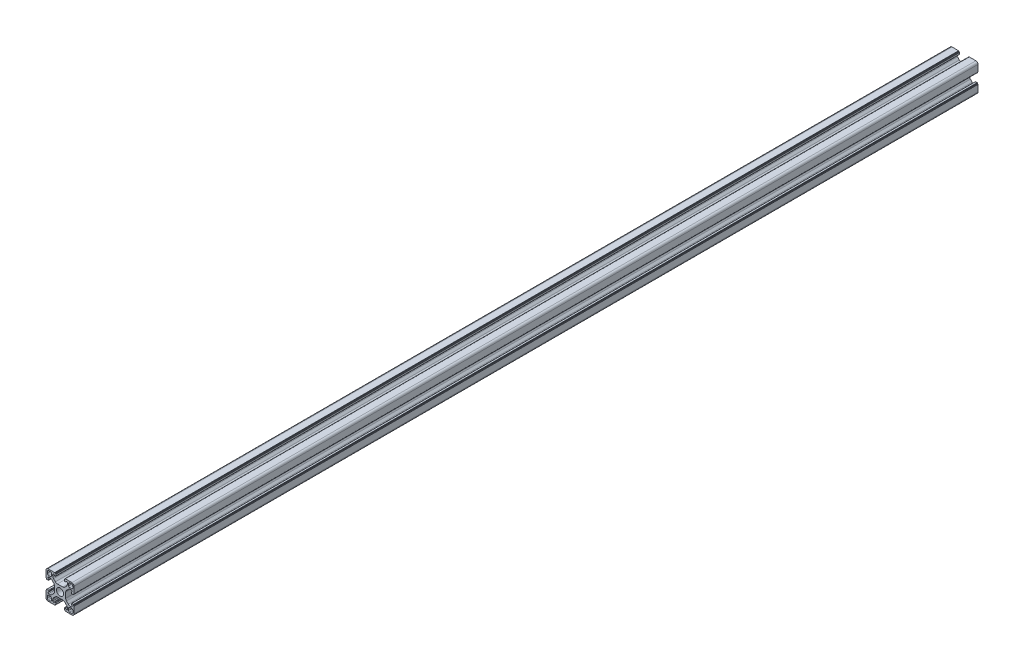
from build123d import *

# Parameters (mm, degrees)
EXTRUDE_1_DEPTH = 644


with BuildPart() as part:
    # Эскиз1 → Бобышка-Вытянуть1 (new body)
    with BuildSketch(Plane.XY):
        with BuildLine():
            Line((-18.466980253, 43.461877394), (-16.568199584, 43.461877394))
            ThreePointArc((-16.568199584, 43.461877394), (-15.80283272, 43.614118329), (-15.153986022, 44.047663832))
            Line((-15.153986022, 44.047663832), (-13.852766691, 45.348883163))
            ThreePointArc((-13.852766691, 45.348883163), (-13.419221188, 45.99772986), (-13.266980253, 46.763096725))
            Line((-13.266980253, 46.763096725), (-13.266980253, 47.661877394))
            ThreePointArc((-13.266980253, 47.661877394), (-13.413426863, 48.015430785), (-13.766980253, 48.161877394))
            Line((-13.766980253, 48.161877394), (-13.869873472, 48.161877394))
            ThreePointArc((-13.869873472, 48.161877394), (-14.061215188, 48.123817161), (-14.223426863, 48.015430785))
            Line((-14.223426863, 48.015430785), (-14.703756949, 47.535100699))
            ThreePointArc((-14.703756949, 47.535100699), (-14.784862786, 47.480907511), (-14.880533644, 47.461877394))
            Line((-14.880533644, 47.461877394), (-15.166980253, 47.461877394))
            ThreePointArc((-15.166980253, 47.461877394), (-15.343756949, 47.535100699), (-15.416980253, 47.711877394))
            Line((-15.416980253, 47.711877394), (-15.416980253, 48.860948215))
            ThreePointArc((-15.416980253, 48.860948215), (-15.373046271, 48.967014232), (-15.266980253, 49.010948215))
            Line((-15.266980253, 49.010948215), (-14.766980253, 49.010948215))
            Line((-14.766980253, 49.010948215), (-14.766980253, 49.311877394))
            ThreePointArc((-14.766980253, 49.311877394), (-14.723046271, 49.417943411), (-14.616980253, 49.461877394))
            Line((-14.616980253, 49.461877394), (-9.966980253, 49.461877394))
            ThreePointArc((-9.966980253, 49.461877394), (-8.906320082, 49.022537566), (-8.466980253, 47.961877394))
            Line((-8.466980253, 47.961877394), (-8.466980253, 43.311877394))
            ThreePointArc((-8.466980253, 43.311877394), (-8.510914236, 43.205811377), (-8.616980253, 43.161877394))
            Line((-8.616980253, 43.161877394), (-8.917909433, 43.161877394))
            Line((-8.917909433, 43.161877394), (-8.917909433, 42.661877394))
            ThreePointArc((-8.917909433, 42.661877394), (-8.961843416, 42.555811377), (-9.067909433, 42.511877394))
            Line((-9.067909433, 42.511877394), (-10.216980253, 42.511877394))
            ThreePointArc((-10.216980253, 42.511877394), (-10.393756949, 42.585100699), (-10.466980253, 42.761877394))
            Line((-10.466980253, 42.761877394), (-10.466980253, 43.048324004))
            ThreePointArc((-10.466980253, 43.048324004), (-10.447950137, 43.143994862), (-10.393756949, 43.225100699))
            Line((-10.393756949, 43.225100699), (-9.913426863, 43.705430785))
            ThreePointArc((-9.913426863, 43.705430785), (-9.805040487, 43.867642459), (-9.766980253, 44.058984175))
            Line((-9.766980253, 44.058984175), (-9.766980253, 44.161877394))
            ThreePointArc((-9.766980253, 44.161877394), (-9.913426863, 44.515430785), (-10.266980253, 44.661877394))
            Line((-10.266980253, 44.661877394), (-11.165760923, 44.661877394))
            ThreePointArc((-11.165760923, 44.661877394), (-11.931127787, 44.509636459), (-12.579974485, 44.076090957))
            Line((-12.579974485, 44.076090957), (-13.881193816, 42.774871626))
            ThreePointArc((-13.881193816, 42.774871626), (-14.314739319, 42.126024928), (-14.466980253, 41.360658063))
            Line((-14.466980253, 41.360658063), (-14.466980253, 39.461877394))
            Line((-14.466980253, 39.461877394), (-14.466980253, 37.563096725))
            ThreePointArc((-14.466980253, 37.563096725), (-14.314739319, 36.79772986), (-13.881193816, 36.148883163))
            Line((-13.881193816, 36.148883163), (-12.579974485, 34.847663832))
            ThreePointArc((-12.579974485, 34.847663832), (-11.931127787, 34.414118329), (-11.165760923, 34.261877394))
            Line((-11.165760923, 34.261877394), (-10.266980253, 34.261877394))
            ThreePointArc((-10.266980253, 34.261877394), (-9.913426863, 34.408324004), (-9.766980253, 34.761877394))
            Line((-9.766980253, 34.761877394), (-9.766980253, 34.864770613))
            ThreePointArc((-9.766980253, 34.864770613), (-9.805040487, 35.056112329), (-9.913426863, 35.218324004))
            Line((-9.913426863, 35.218324004), (-10.393756949, 35.69865409))
            ThreePointArc((-10.393756949, 35.69865409), (-10.447950137, 35.779759927), (-10.466980253, 35.875430785))
            Line((-10.466980253, 35.875430785), (-10.466980253, 36.161877394))
            ThreePointArc((-10.466980253, 36.161877394), (-10.393756949, 36.33865409), (-10.216980253, 36.411877394))
            Line((-10.216980253, 36.411877394), (-9.067909433, 36.411877394))
            ThreePointArc((-9.067909433, 36.411877394), (-8.961843416, 36.367943411), (-8.917909433, 36.261877394))
            Line((-8.917909433, 36.261877394), (-8.917909433, 35.761877394))
            Line((-8.917909433, 35.761877394), (-8.616980253, 35.761877394))
            ThreePointArc((-8.616980253, 35.761877394), (-8.510914236, 35.717943411), (-8.466980253, 35.611877394))
            Line((-8.466980253, 35.611877394), (-8.466980253, 30.961877394))
            ThreePointArc((-8.466980253, 30.961877394), (-8.906320082, 29.901217222), (-9.966980253, 29.461877394))
            Line((-9.966980253, 29.461877394), (-14.616980253, 29.461877394))
            ThreePointArc((-14.616980253, 29.461877394), (-14.723046271, 29.505811377), (-14.766980253, 29.611877394))
            Line((-14.766980253, 29.611877394), (-14.766980253, 29.912806574))
            Line((-14.766980253, 29.912806574), (-15.266980253, 29.912806574))
            ThreePointArc((-15.266980253, 29.912806574), (-15.373046271, 29.956740557), (-15.416980253, 30.062806574))
            Line((-15.416980253, 30.062806574), (-15.416980253, 31.211877394))
            ThreePointArc((-15.416980253, 31.211877394), (-15.343756949, 31.38865409), (-15.166980253, 31.461877394))
            Line((-15.166980253, 31.461877394), (-14.880533644, 31.461877394))
            ThreePointArc((-14.880533644, 31.461877394), (-14.784862786, 31.442847277), (-14.703756949, 31.38865409))
            Line((-14.703756949, 31.38865409), (-14.223426863, 30.908324004))
            ThreePointArc((-14.223426863, 30.908324004), (-14.061215188, 30.799937628), (-13.869873472, 30.761877394))
            Line((-13.869873472, 30.761877394), (-13.766980253, 30.761877394))
            ThreePointArc((-13.766980253, 30.761877394), (-13.413426863, 30.908324004), (-13.266980253, 31.261877394))
            Line((-13.266980253, 31.261877394), (-13.266980253, 32.160658063))
            ThreePointArc((-13.266980253, 32.160658063), (-13.419221188, 32.926024928), (-13.852766691, 33.574871626))
            Line((-13.852766691, 33.574871626), (-15.153986022, 34.876090957))
            ThreePointArc((-15.153986022, 34.876090957), (-15.80283272, 35.309636459), (-16.568199584, 35.461877394))
            Line((-16.568199584, 35.461877394), (-18.466980253, 35.461877394))
            Line((-18.466980253, 35.461877394), (-20.365760923, 35.461877394))
            ThreePointArc((-20.365760923, 35.461877394), (-21.131127787, 35.309636459), (-21.779974485, 34.876090957))
            Line((-21.779974485, 34.876090957), (-23.081193816, 33.574871626))
            ThreePointArc((-23.081193816, 33.574871626), (-23.514739319, 32.926024928), (-23.666980253, 32.160658063))
            Line((-23.666980253, 32.160658063), (-23.666980253, 31.261877394))
            ThreePointArc((-23.666980253, 31.261877394), (-23.520533644, 30.908324004), (-23.166980253, 30.761877394))
            Line((-23.166980253, 30.761877394), (-23.064087035, 30.761877394))
            ThreePointArc((-23.064087035, 30.761877394), (-22.872745319, 30.799937628), (-22.710533644, 30.908324004))
            Line((-22.710533644, 30.908324004), (-22.230203558, 31.38865409))
            ThreePointArc((-22.230203558, 31.38865409), (-22.149097721, 31.442847277), (-22.053426863, 31.461877394))
            Line((-22.053426863, 31.461877394), (-21.766980253, 31.461877394))
            ThreePointArc((-21.766980253, 31.461877394), (-21.590203558, 31.38865409), (-21.516980253, 31.211877394))
            Line((-21.516980253, 31.211877394), (-21.516980253, 30.062806574))
            ThreePointArc((-21.516980253, 30.062806574), (-21.560914236, 29.956740557), (-21.666980253, 29.912806574))
            Line((-21.666980253, 29.912806574), (-22.166980253, 29.912806574))
            Line((-22.166980253, 29.912806574), (-22.166980253, 29.611877394))
            ThreePointArc((-22.166980253, 29.611877394), (-22.210914236, 29.505811377), (-22.316980253, 29.461877394))
            Line((-22.316980253, 29.461877394), (-26.966980253, 29.461877394))
            ThreePointArc((-26.966980253, 29.461877394), (-28.027640425, 29.901217222), (-28.466980253, 30.961877394))
            Line((-28.466980253, 30.961877394), (-28.466980253, 35.611877394))
            ThreePointArc((-28.466980253, 35.611877394), (-28.423046271, 35.717943411), (-28.316980253, 35.761877394))
            Line((-28.316980253, 35.761877394), (-28.016051074, 35.761877394))
            Line((-28.016051074, 35.761877394), (-28.016051074, 36.261877394))
            ThreePointArc((-28.016051074, 36.261877394), (-27.972117091, 36.367943411), (-27.866051074, 36.411877394))
            Line((-27.866051074, 36.411877394), (-26.716980253, 36.411877394))
            ThreePointArc((-26.716980253, 36.411877394), (-26.540203558, 36.33865409), (-26.466980253, 36.161877394))
            Line((-26.466980253, 36.161877394), (-26.466980253, 35.875430785))
            ThreePointArc((-26.466980253, 35.875430785), (-26.48601037, 35.779759927), (-26.540203558, 35.69865409))
            Line((-26.540203558, 35.69865409), (-27.020533644, 35.218324004))
            ThreePointArc((-27.020533644, 35.218324004), (-27.12892002, 35.056112329), (-27.166980253, 34.864770613))
            Line((-27.166980253, 34.864770613), (-27.166980253, 34.761877394))
            ThreePointArc((-27.166980253, 34.761877394), (-27.020533644, 34.408324004), (-26.666980253, 34.261877394))
            Line((-26.666980253, 34.261877394), (-25.768199584, 34.261877394))
            ThreePointArc((-25.768199584, 34.261877394), (-25.00283272, 34.414118329), (-24.353986022, 34.847663832))
            Line((-24.353986022, 34.847663832), (-23.052766691, 36.148883163))
            ThreePointArc((-23.052766691, 36.148883163), (-22.619221188, 36.79772986), (-22.466980253, 37.563096725))
            Line((-22.466980253, 37.563096725), (-22.466980253, 39.461877394))
            Line((-22.466980253, 39.461877394), (-22.466980253, 41.360658063))
            ThreePointArc((-22.466980253, 41.360658063), (-22.619221188, 42.126024928), (-23.052766691, 42.774871626))
            Line((-23.052766691, 42.774871626), (-24.353986022, 44.076090957))
            ThreePointArc((-24.353986022, 44.076090957), (-25.00283272, 44.509636459), (-25.768199584, 44.661877394))
            Line((-25.768199584, 44.661877394), (-26.666980253, 44.661877394))
            ThreePointArc((-26.666980253, 44.661877394), (-27.020533644, 44.515430785), (-27.166980253, 44.161877394))
            Line((-27.166980253, 44.161877394), (-27.166980253, 44.058984175))
            ThreePointArc((-27.166980253, 44.058984175), (-27.12892002, 43.867642459), (-27.020533644, 43.705430785))
            Line((-27.020533644, 43.705430785), (-26.540203558, 43.225100699))
            ThreePointArc((-26.540203558, 43.225100699), (-26.48601037, 43.143994862), (-26.466980253, 43.048324004))
            Line((-26.466980253, 43.048324004), (-26.466980253, 42.761877394))
            ThreePointArc((-26.466980253, 42.761877394), (-26.540203558, 42.585100699), (-26.716980253, 42.511877394))
            Line((-26.716980253, 42.511877394), (-27.866051074, 42.511877394))
            ThreePointArc((-27.866051074, 42.511877394), (-27.972117091, 42.555811377), (-28.016051074, 42.661877394))
            Line((-28.016051074, 42.661877394), (-28.016051074, 43.161877394))
            Line((-28.016051074, 43.161877394), (-28.316980253, 43.161877394))
            ThreePointArc((-28.316980253, 43.161877394), (-28.423046271, 43.205811377), (-28.466980253, 43.311877394))
            Line((-28.466980253, 43.311877394), (-28.466980253, 47.961877394))
            ThreePointArc((-28.466980253, 47.961877394), (-28.027640425, 49.022537566), (-26.966980253, 49.461877394))
            Line((-26.966980253, 49.461877394), (-22.316980253, 49.461877394))
            ThreePointArc((-22.316980253, 49.461877394), (-22.210914236, 49.417943411), (-22.166980253, 49.311877394))
            Line((-22.166980253, 49.311877394), (-22.166980253, 49.010948215))
            Line((-22.166980253, 49.010948215), (-21.666980253, 49.010948215))
            ThreePointArc((-21.666980253, 49.010948215), (-21.560914236, 48.967014232), (-21.516980253, 48.860948215))
            Line((-21.516980253, 48.860948215), (-21.516980253, 47.711877394))
            ThreePointArc((-21.516980253, 47.711877394), (-21.590203558, 47.535100699), (-21.766980253, 47.461877394))
            Line((-21.766980253, 47.461877394), (-22.053426863, 47.461877394))
            ThreePointArc((-22.053426863, 47.461877394), (-22.149097721, 47.480907511), (-22.230203558, 47.535100699))
            Line((-22.230203558, 47.535100699), (-22.710533644, 48.015430785))
            ThreePointArc((-22.710533644, 48.015430785), (-22.872745319, 48.123817161), (-23.064087035, 48.161877394))
            Line((-23.064087035, 48.161877394), (-23.166980253, 48.161877394))
            ThreePointArc((-23.166980253, 48.161877394), (-23.520533644, 48.015430785), (-23.666980253, 47.661877394))
            Line((-23.666980253, 47.661877394), (-23.666980253, 46.763096725))
            ThreePointArc((-23.666980253, 46.763096725), (-23.514739319, 45.99772986), (-23.081193816, 45.348883163))
            Line((-23.081193816, 45.348883163), (-21.779974485, 44.047663832))
            ThreePointArc((-21.779974485, 44.047663832), (-21.131127787, 43.614118329), (-20.365760923, 43.461877394))
            Line((-20.365760923, 43.461877394), (-18.466980253, 43.461877394))
        make_face()
        with BuildLine():
            Line((-11.566980253, 45.561877394), (-10.166980253, 45.561877394))
            ThreePointArc((-10.166980253, 45.561877394), (-9.601294829, 45.796191969), (-9.366980253, 46.361877394))
            Line((-9.366980253, 46.361877394), (-9.366980253, 47.761877394))
            ThreePointArc((-9.366980253, 47.761877394), (-9.601294829, 48.327562819), (-10.166980253, 48.561877394))
            Line((-10.166980253, 48.561877394), (-11.566980253, 48.561877394))
            ThreePointArc((-11.566980253, 48.561877394), (-12.132665678, 48.327562819), (-12.366980253, 47.761877394))
            Line((-12.366980253, 47.761877394), (-12.366980253, 46.361877394))
            ThreePointArc((-12.366980253, 46.361877394), (-12.132665678, 45.796191969), (-11.566980253, 45.561877394))
        make_face(mode=Mode.SUBTRACT)
        with BuildLine():
            Line((-12.366980253, 32.561877394), (-12.366980253, 31.161877394))
            ThreePointArc((-12.366980253, 31.161877394), (-12.132665678, 30.596191969), (-11.566980253, 30.361877394))
            Line((-11.566980253, 30.361877394), (-10.166980253, 30.361877394))
            ThreePointArc((-10.166980253, 30.361877394), (-9.601294829, 30.596191969), (-9.366980253, 31.161877394))
            Line((-9.366980253, 31.161877394), (-9.366980253, 32.561877394))
            ThreePointArc((-9.366980253, 32.561877394), (-9.601294829, 33.127562819), (-10.166980253, 33.361877394))
            Line((-10.166980253, 33.361877394), (-11.566980253, 33.361877394))
            ThreePointArc((-11.566980253, 33.361877394), (-12.132665678, 33.127562819), (-12.366980253, 32.561877394))
        make_face(mode=Mode.SUBTRACT)
        with BuildLine():
            Line((-25.366980253, 33.361877394), (-26.766980253, 33.361877394))
            ThreePointArc((-26.766980253, 33.361877394), (-27.332665678, 33.127562819), (-27.566980253, 32.561877394))
            Line((-27.566980253, 32.561877394), (-27.566980253, 31.161877394))
            ThreePointArc((-27.566980253, 31.161877394), (-27.332665678, 30.596191969), (-26.766980253, 30.361877394))
            Line((-26.766980253, 30.361877394), (-25.366980253, 30.361877394))
            ThreePointArc((-25.366980253, 30.361877394), (-24.801294829, 30.596191969), (-24.566980253, 31.161877394))
            Line((-24.566980253, 31.161877394), (-24.566980253, 32.561877394))
            ThreePointArc((-24.566980253, 32.561877394), (-24.801294829, 33.127562819), (-25.366980253, 33.361877394))
        make_face(mode=Mode.SUBTRACT)
        with BuildLine():
            Line((-24.566980253, 46.361877394), (-24.566980253, 47.761877394))
            ThreePointArc((-24.566980253, 47.761877394), (-24.801294829, 48.327562819), (-25.366980253, 48.561877394))
            Line((-25.366980253, 48.561877394), (-26.766980253, 48.561877394))
            ThreePointArc((-26.766980253, 48.561877394), (-27.332665678, 48.327562819), (-27.566980253, 47.761877394))
            Line((-27.566980253, 47.761877394), (-27.566980253, 46.361877394))
            ThreePointArc((-27.566980253, 46.361877394), (-27.332665678, 45.796191969), (-26.766980253, 45.561877394))
            Line((-26.766980253, 45.561877394), (-25.366980253, 45.561877394))
            ThreePointArc((-25.366980253, 45.561877394), (-24.801294829, 45.796191969), (-24.566980253, 46.361877394))
        make_face(mode=Mode.SUBTRACT)
        with BuildLine():
            ThreePointArc((-15.966980253, 39.461877394), (-16.699213301, 41.229644347), (-18.466980253, 41.961877394))
            ThreePointArc((-18.466980253, 41.961877394), (-20.234747206, 41.229644347), (-20.966980253, 39.461877394))
            ThreePointArc((-20.966980253, 39.461877394), (-20.234747206, 37.694110441), (-18.466980253, 36.961877394))
            ThreePointArc((-18.466980253, 36.961877394), (-16.699213301, 37.694110441), (-15.966980253, 39.461877394))
        make_face(mode=Mode.SUBTRACT)
    extrude(amount=EXTRUDE_1_DEPTH)


solid = part.part
